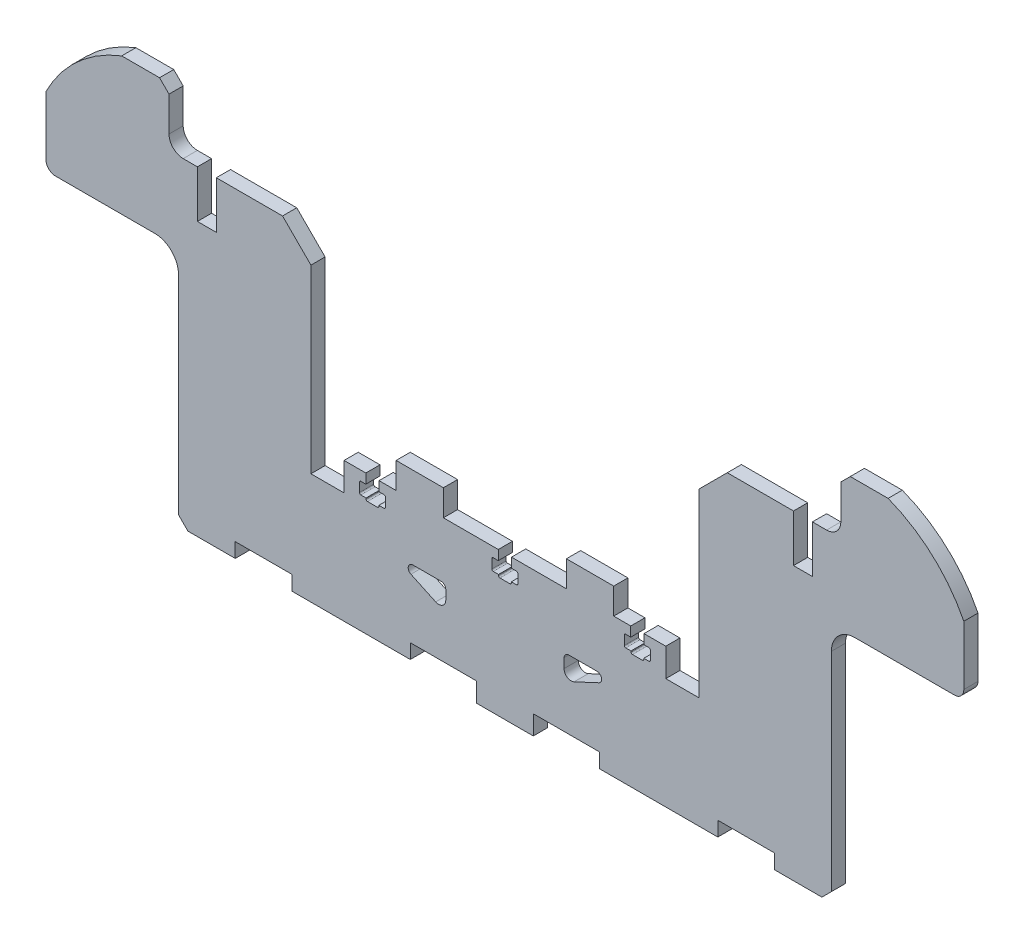
from build123d import *

# Parameters (mm, degrees)
EXTRUDE_1_DEPTH = 3


with BuildPart() as part:
    # 草图1 → 凸台-拉伸1 (new body)
    with BuildSketch(Plane(origin=(0, 0, 0), x_dir=(-1, 0, 0), z_dir=(0, 0, 1))):
        with BuildLine():
            Line((-132.77617551, 2.029328632), (-134.77617551, 4.029328632))
            Line((-134.77617551, 4.029328632), (-144.77617551, 4.029328632))
            Line((-144.77617551, 4.029328632), (-144.77617551, 0.948486637))
            Line((-144.77617551, 0.948486637), (-156.77617551, 0.948486637))
            Line((-156.77617551, 0.948486637), (-156.77617551, 4.029328632))
            Line((-156.77617551, 4.029328632), (-181.77617551, 4.029328632))
            Line((-181.77617551, 4.029328632), (-181.77617551, 0.948486637))
            Line((-181.77617551, 0.948486637), (-195.77617551, 0.948486637))
            Line((-195.77617551, 0.948486637), (-195.77617551, 5.029328632))
            Line((-195.77617551, 5.029328632), (-207.77617551, 5.029328632))
            Line((-207.77617551, 5.029328632), (-207.77617551, 0.948486637))
            Line((-207.77617551, 0.948486637), (-221.77617551, 0.948486637))
            Line((-221.77617551, 0.948486637), (-221.77617551, 4.029328632))
            Line((-221.77617551, 4.029328632), (-246.77617551, 4.029328632))
            Line((-246.77617551, 4.029328632), (-246.77617551, 0.948486637))
            Line((-246.77617551, 0.948486637), (-258.77617551, 0.948486637))
            Line((-258.77617551, 0.948486637), (-258.77617551, 4.029328632))
            Line((-258.77617551, 4.029328632), (-268.77617551, 4.029328632))
            Line((-268.77617551, 4.029328632), (-270.77617551, 2.029328632))
            Line((-270.77617551, 2.029328632), (-270.77617551, -41.970671368))
            ThreePointArc((-270.77617551, -41.970671368), (-272.240641604, -45.506205274), (-275.77617551, -46.970671368))
            Line((-275.77617551, -46.970671368), (-296.77617551, -46.970671368))
            ThreePointArc((-296.77617551, -46.970671368), (-298.190389072, -47.556457806), (-298.77617551, -48.970671368))
            Line((-298.77617551, -48.970671368), (-298.77617551, -61.470671368))
            ThreePointArc((-298.77617551, -61.470671368), (-292.125960742, -70.210089556), (-282.77617551, -75.970671368))
            Line((-282.77617551, -75.970671368), (-274.77617551, -75.970671368))
            Line((-274.77617551, -75.970671368), (-272.77617551, -73.970671368))
            Line((-272.77617551, -73.970671368), (-272.77617551, -66.665321612))
            ThreePointArc((-272.77617551, -66.665321612), (-271.897495853, -64.544001269), (-269.77617551, -63.665321612))
            Line((-269.77617551, -63.665321612), (-266.77617551, -63.665321612))
            Line((-266.77617551, -63.665321612), (-266.77617551, -53.665321612))
            Line((-266.77617551, -53.665321612), (-262.77617551, -53.665321612))
            Line((-262.77617551, -53.665321612), (-262.77617551, -63.665321612))
            Line((-262.77617551, -63.665321612), (-248.77617551, -63.665321612))
            Line((-248.77617551, -63.665321612), (-242.77617551, -57.665321612))
            Line((-242.77617551, -57.665321612), (-242.77617551, -19.470671368))
            Line((-242.77617551, -19.470671368), (-235.77617551, -19.470671368))
            Line((-235.77617551, -19.470671368), (-235.77617551, -25.415321612))
            Line((-235.77617551, -25.415321612), (-231.17617551, -25.415321612))
            Line((-231.17617551, -25.415321612), (-231.17617551, -23.370671368))
            Line((-231.17617551, -23.370671368), (-232.22617551, -23.370671368))
            ThreePointArc((-232.22617551, -23.370671368), (-232.438307544, -23.282803402), (-232.52617551, -23.070671368))
            Line((-232.52617551, -23.070671368), (-232.52617551, -21.170671368))
            ThreePointArc((-232.52617551, -21.170671368), (-232.438307544, -20.958539334), (-232.22617551, -20.870671368))
            Line((-232.22617551, -20.870671368), (-231.12617551, -20.870671368))
            Line((-231.12617551, -20.870671368), (-231.12617551, -20.670671368))
            ThreePointArc((-231.12617551, -20.670671368), (-231.038307544, -20.458539334), (-230.82617551, -20.370671368))
            Line((-230.82617551, -20.370671368), (-228.72617551, -20.370671368))
            ThreePointArc((-228.72617551, -20.370671368), (-228.514043475, -20.458539334), (-228.42617551, -20.670671368))
            Line((-228.42617551, -20.670671368), (-228.42617551, -20.870671368))
            Line((-228.42617551, -20.870671368), (-227.32617551, -20.870671368))
            ThreePointArc((-227.32617551, -20.870671368), (-227.114043475, -20.958539334), (-227.02617551, -21.170671368))
            Line((-227.02617551, -21.170671368), (-227.02617551, -23.070671368))
            ThreePointArc((-227.02617551, -23.070671368), (-227.114043475, -23.282803402), (-227.32617551, -23.370671368))
            Line((-227.32617551, -23.370671368), (-228.37617551, -23.370671368))
            Line((-228.37617551, -23.370671368), (-228.37617551, -25.415321612))
            Line((-228.37617551, -25.415321612), (-224.77617551, -25.415321612))
            Line((-224.77617551, -25.415321612), (-224.77617551, -30.915321612))
            Line((-224.77617551, -30.915321612), (-214.77617551, -30.915321612))
            Line((-214.77617551, -30.915321612), (-214.77617551, -25.415321612))
            Line((-214.77617551, -25.415321612), (-203.17617551, -25.415321612))
            Line((-203.17617551, -25.415321612), (-203.17617551, -23.370671368))
            Line((-203.17617551, -23.370671368), (-204.22617551, -23.370671368))
            ThreePointArc((-204.22617551, -23.370671368), (-204.438307544, -23.282803402), (-204.52617551, -23.070671368))
            Line((-204.52617551, -23.070671368), (-204.52617551, -21.170671368))
            ThreePointArc((-204.52617551, -21.170671368), (-204.438307544, -20.958539334), (-204.22617551, -20.870671368))
            Line((-204.22617551, -20.870671368), (-203.12617551, -20.870671368))
            Line((-203.12617551, -20.870671368), (-203.12617551, -20.670671368))
            ThreePointArc((-203.12617551, -20.670671368), (-203.038307544, -20.458539334), (-202.82617551, -20.370671368))
            Line((-202.82617551, -20.370671368), (-200.72617551, -20.370671368))
            ThreePointArc((-200.72617551, -20.370671368), (-200.514043475, -20.458539334), (-200.42617551, -20.670671368))
            Line((-200.42617551, -20.670671368), (-200.42617551, -20.870671368))
            Line((-200.42617551, -20.870671368), (-199.32617551, -20.870671368))
            ThreePointArc((-199.32617551, -20.870671368), (-199.114043475, -20.958539334), (-199.02617551, -21.170671368))
            Line((-199.02617551, -21.170671368), (-199.02617551, -23.070671368))
            ThreePointArc((-199.02617551, -23.070671368), (-199.114043475, -23.282803402), (-199.32617551, -23.370671368))
            Line((-199.32617551, -23.370671368), (-200.37617551, -23.370671368))
            Line((-200.37617551, -23.370671368), (-200.37617551, -25.415321612))
            Line((-200.37617551, -25.415321612), (-188.77617551, -25.415321612))
            Line((-188.77617551, -25.415321612), (-188.77617551, -30.915321612))
            Line((-188.77617551, -30.915321612), (-178.77617551, -30.915321612))
            Line((-178.77617551, -30.915321612), (-178.77617551, -25.415321612))
            Line((-178.77617551, -25.415321612), (-175.17617551, -25.415321612))
            Line((-175.17617551, -25.415321612), (-175.17617551, -23.370671368))
            Line((-175.17617551, -23.370671368), (-176.22617551, -23.370671368))
            ThreePointArc((-176.22617551, -23.370671368), (-176.438307544, -23.282803402), (-176.52617551, -23.070671368))
            Line((-176.52617551, -23.070671368), (-176.52617551, -21.170671368))
            ThreePointArc((-176.52617551, -21.170671368), (-176.438307544, -20.958539334), (-176.22617551, -20.870671368))
            Line((-176.22617551, -20.870671368), (-175.12617551, -20.870671368))
            Line((-175.12617551, -20.870671368), (-175.12617551, -20.670671368))
            ThreePointArc((-175.12617551, -20.670671368), (-175.038307544, -20.458539334), (-174.82617551, -20.370671368))
            Line((-174.82617551, -20.370671368), (-172.72617551, -20.370671368))
            ThreePointArc((-172.72617551, -20.370671368), (-172.514043475, -20.458539334), (-172.42617551, -20.670671368))
            Line((-172.42617551, -20.670671368), (-172.42617551, -20.870671368))
            Line((-172.42617551, -20.870671368), (-171.32617551, -20.870671368))
            ThreePointArc((-171.32617551, -20.870671368), (-171.114043475, -20.958539334), (-171.02617551, -21.170671368))
            Line((-171.02617551, -21.170671368), (-171.02617551, -23.070671368))
            ThreePointArc((-171.02617551, -23.070671368), (-171.114043475, -23.282803402), (-171.32617551, -23.370671368))
            Line((-171.32617551, -23.370671368), (-172.37617551, -23.370671368))
            Line((-172.37617551, -23.370671368), (-172.37617551, -25.415321612))
            Line((-172.37617551, -25.415321612), (-167.77617551, -25.415321612))
            Line((-167.77617551, -25.415321612), (-167.77617551, -19.470671368))
            Line((-167.77617551, -19.470671368), (-160.77617551, -19.470671368))
            Line((-160.77617551, -19.470671368), (-160.77617551, -57.665321612))
            Line((-160.77617551, -57.665321612), (-154.77617551, -63.665321612))
            Line((-154.77617551, -63.665321612), (-140.77617551, -63.665321612))
            Line((-140.77617551, -63.665321612), (-140.77617551, -53.665321612))
            Line((-140.77617551, -53.665321612), (-136.77617551, -53.665321612))
            Line((-136.77617551, -53.665321612), (-136.77617551, -63.665321612))
            Line((-136.77617551, -63.665321612), (-133.77617551, -63.665321612))
            ThreePointArc((-133.77617551, -63.665321612), (-131.654855166, -64.544001269), (-130.77617551, -66.665321612))
            Line((-130.77617551, -66.665321612), (-130.77617551, -73.970671368))
            Line((-130.77617551, -73.970671368), (-128.77617551, -75.970671368))
            Line((-128.77617551, -75.970671368), (-120.77617551, -75.970671368))
            ThreePointArc((-120.77617551, -75.970671368), (-111.426390277, -70.210089556), (-104.77617551, -61.470671368))
            Line((-104.77617551, -61.470671368), (-104.77617551, -48.970671368))
            ThreePointArc((-104.77617551, -48.970671368), (-105.361961947, -47.556457806), (-106.77617551, -46.970671368))
            Line((-106.77617551, -46.970671368), (-127.77617551, -46.970671368))
            ThreePointArc((-127.77617551, -46.970671368), (-131.311709416, -45.506205274), (-132.77617551, -41.970671368))
            Line((-132.77617551, -41.970671368), (-132.77617551, 2.029328632))
        make_face()
        with BuildLine():
            Line((-187.141847312, -9.202827725), (-181.907913386, -11.645330223))
            ThreePointArc((-181.907913386, -11.645330223), (-181.354534763, -12.768096904), (-182.330798852, -13.551513363))
            Line((-182.330798852, -13.551513363), (-188.27617551, -13.551513363))
            ThreePointArc((-188.27617551, -13.551513363), (-188.983282291, -13.258620144), (-189.27617551, -12.551513363))
            Line((-189.27617551, -12.551513363), (-189.27617551, -10.562102435))
            ThreePointArc((-189.27617551, -10.562102435), (-188.58193841, -9.296896464), (-187.141847312, -9.202827725))
        make_face(mode=Mode.SUBTRACT)
        with BuildLine():
            Line((-221.644437633, -11.645330223), (-216.410503708, -9.202827725))
            ThreePointArc((-216.410503708, -9.202827725), (-214.970412609, -9.296896464), (-214.27617551, -10.562102435))
            Line((-214.27617551, -10.562102435), (-214.27617551, -12.551513363))
            ThreePointArc((-214.27617551, -12.551513363), (-214.569068729, -13.258620144), (-215.27617551, -13.551513363))
            Line((-215.27617551, -13.551513363), (-221.221552168, -13.551513363))
            ThreePointArc((-221.221552168, -13.551513363), (-222.197816256, -12.768096904), (-221.644437633, -11.645330223))
        make_face(mode=Mode.SUBTRACT)
    extrude(amount=EXTRUDE_1_DEPTH)


solid = part.part
